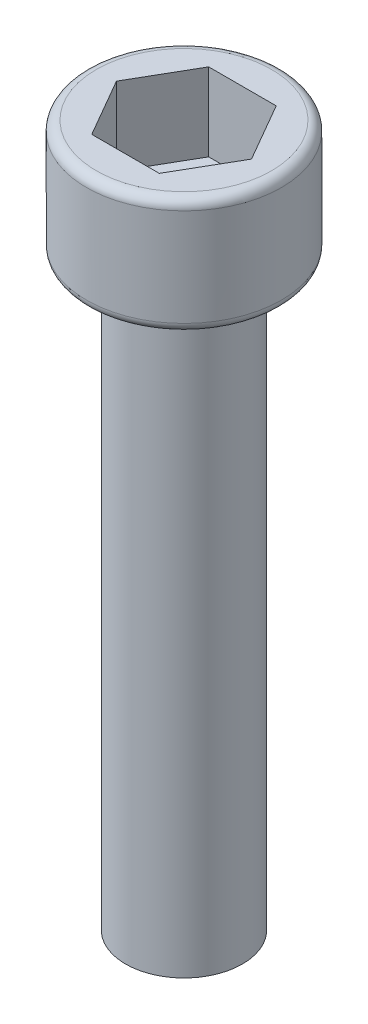
from build123d import *

# Parameters (mm, degrees)
CUT_EXTRUDE1_DEPTH = 2
FILLET1_R          = 0.25


with BuildPart() as part:
    # Sketch1 → Revolve1 (revolve)
    with BuildSketch(Plane.XY):
        Polygon((0, -9), (1.5, -9), (1.5, 6), (2.5, 6), (2.5, 9), (0, 9), align=None)
    revolve(axis=Axis((0, -1000, 0), (0, 1, 0)))

    # Sketch2 → Cut-Extrude1 (cut)
    with BuildSketch(Plane(origin=(0, 9, 0), x_dir=(1, 0, 0), z_dir=(0, 1, 0))):
        Polygon((0.866025404, 1.5), (-0.866025404, 1.5), (-1.732050808, 0), (-0.866025404, -1.5), (0.866025404, -1.5), (1.732050808, 0), align=None)
    extrude(amount=-CUT_EXTRUDE1_DEPTH, mode=Mode.SUBTRACT)

    # Fillet1
    fillet1_edges = [part.edges().sort_by_distance(p)[0] for p in [
        (-2.5, 9, 0),
        (-2.5, 6, 0),
    ]]
    fillet(fillet1_edges, radius=FILLET1_R)


solid = part.part
